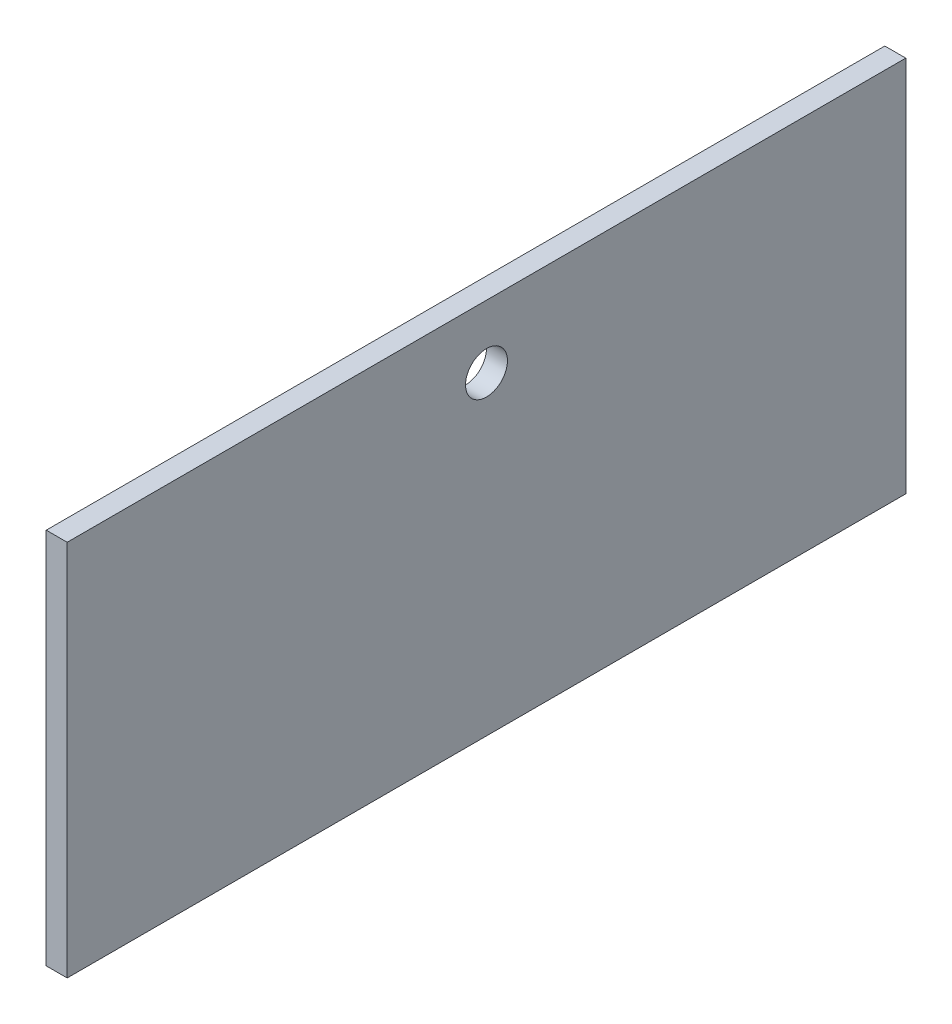
from build123d import *

# Parameters (mm, degrees)
SKETCH1_W           = 150
SKETCH1_H           = 200
BOSS_EXTRUDE1_DEPTH = 100
SHELL2_T            = -5
SKETCH5_R           = 1.9
CUT_EXTRUDE2_DEPTH  = 10
BOSS_EXTRUDE4_DEPTH = 200
SKETCH9_W           = 101.133931545
SKETCH9_H           = 31.996148617
CUT_EXTRUDE4_DEPTH  = 236.849528301
SKETCH10_R          = 4
CUT_EXTRUDE5_DEPTH  = 10
CUT_EXTRUDE7_REACH  = 162.078
SKETCH11_W          = 140
SKETCH11_H          = 5
SKETCH15_R          = 1.2
CUT_EXTRUDE11_DEPTH = 10
SKETCH36_W          = 60
SKETCH36_H          = 5
BOSS_EXTRUDE7_DEPTH = 10
SKETCH37_R          = 3.5
CUT_EXTRUDE15_DEPTH = 60
SKETCH38_R          = 5
CUT_EXTRUDE16_DEPTH = 70
SKETCH41_W          = 161.400055229
SKETCH41_H          = 90
CUT_EXTRUDE19_DEPTH = 236.849528301


with BuildPart() as part:
    # Sketch1 → Boss-Extrude1 (new body)
    with BuildSketch(Plane(origin=(0, 0, 0), x_dir=(1, 0, 0), z_dir=(0, 1, 0))):
        Rectangle(SKETCH1_W, SKETCH1_H)
    extrude(amount=BOSS_EXTRUDE1_DEPTH)

    # Shell2
    shell2_openings = [part.faces().sort_by_distance(p)[0] for p in [
        (0, 50, -100),
        (0, 50, 100),
    ]]
    offset(amount=SHELL2_T, openings=shell2_openings, kind=Kind.INTERSECTION)

    # Sketch5 → Cut-Extrude2 (cut)
    with BuildSketch(Plane.XZ):
        with Locations(Location((-65, 91, 0), (0, 0, 270))):
            Circle(SKETCH5_R)
        with Locations(Location((-35, 91, 0), (0, 0, 270))):
            Circle(SKETCH5_R)
        with Locations(Location((-65, 67, 0), (0, 0, 270))):
            Circle(SKETCH5_R)
        with Locations(Location((-35, 67, 0), (0, 0, 270))):
            Circle(SKETCH5_R)
    cut_extrude2 = extrude(amount=-CUT_EXTRUDE2_DEPTH, mode=Mode.SUBTRACT)

    # Mirror2: Cut-Extrude2 across plane
    add(cut_extrude2.mirror(Plane.XY), mode=Mode.SUBTRACT)

    # Sketch8 → Boss-Extrude4 (add, through all)
    with BuildSketch(Plane.XY.offset(100)):
        Polygon((-15, 17), (75, 17), (75, 22), (-20, 22), (-20, 0), (-15, 0), align=None)
    extrude(amount=-BOSS_EXTRUDE4_DEPTH)

    # Sketch9 → Cut-Extrude4 (cut, through all)
    with BuildSketch(Plane.XY.offset(100)):
        with Locations((35.566965773, 1.001925691)):
            Rectangle(SKETCH9_W, SKETCH9_H)
    extrude(amount=-CUT_EXTRUDE4_DEPTH, mode=Mode.SUBTRACT)

    # Sketch10 → Cut-Extrude5 (cut)
    with BuildSketch(Plane.XZ.offset(-17)):
        with Locations((60, 0)):
            Circle(SKETCH10_R)
    extrude(amount=-CUT_EXTRUDE5_DEPTH, mode=Mode.SUBTRACT)

    # Cut-Extrude7: up to this face of the body (flat: up to its plane)
    cut_extrude7_end = Plane(part.part.faces().sort_by_distance((-44.954220044, 5, 0))[0])
    # Sketch11 → Cut-Extrude7 (cut, up to the picked face)
    with BuildSketch(Plane(origin=(0, 100, 0), x_dir=(1, 0, 0), z_dir=(0, 1, 0)), mode=Mode.PRIVATE) as cut_extrude7_sk1:
        with Locations((0, -92.5)):
            Rectangle(SKETCH11_W, SKETCH11_H)
    cut_extrude7_tool1 = split(extrude(cut_extrude7_sk1.sketch, amount=-CUT_EXTRUDE7_REACH, mode=Mode.PRIVATE), bisect_by=cut_extrude7_end, keep=Keep.BOTH, mode=Mode.PRIVATE)
    cut_extrude7 = cut_extrude7_tool1.solids().sort_by(Axis((0, 100, 92.5), (0, -1, 0)))[0]
    add(cut_extrude7, mode=Mode.SUBTRACT)

    # Mirror3: Cut-Extrude7 across plane
    add(cut_extrude7.mirror(Plane.XY), mode=Mode.SUBTRACT)

    # Sketch15 → Cut-Extrude11 (cut)
    with BuildSketch(Plane(origin=(0, 100, 0), x_dir=(1, 0, 0), z_dir=(0, 1, 0))):
        with Locations(Location((50, 28, 0), (0, 0, 270))):
            Circle(SKETCH15_R)
        with Locations(Location((50, -28, 0), (0, 0, 270))):
            Circle(SKETCH15_R)
        with Locations(Location((-20, 20, 0), (0, 0, 270))):
            Circle(SKETCH15_R)
        with Locations(Location((-20, -20, 0), (0, 0, 270))):
            Circle(SKETCH15_R)
    extrude(amount=-CUT_EXTRUDE11_DEPTH, mode=Mode.SUBTRACT)

    # Sketch36 → Boss-Extrude7 (add)
    with BuildSketch(Plane.ZY.offset(-70)):
        with Locations((-13.202053215, 62.5)):
            Rectangle(SKETCH36_W, SKETCH36_H)
    boss_extrude7 = extrude(amount=BOSS_EXTRUDE7_DEPTH)

    # Mirror5: Boss-Extrude7 across plane
    add(boss_extrude7.mirror(Plane(origin=(0, 0, 0), x_dir=(0, 0, 1), z_dir=(1, 0, 0))))

    # Sketch37 → Cut-Extrude15 (cut)
    with BuildSketch(Plane(origin=(75, 0, 0), x_dir=(0, 0, -1), z_dir=(1, 0, 0))):
        with Locations((0, 75)):
            Circle(SKETCH37_R)
    extrude(amount=-CUT_EXTRUDE15_DEPTH, mode=Mode.SUBTRACT)

    # Sketch38 → Cut-Extrude16 (cut)
    with BuildSketch(Plane.ZY.offset(75)):
        with Locations((0, 80)):
            Circle(SKETCH38_R)
    extrude(amount=-CUT_EXTRUDE16_DEPTH, mode=Mode.SUBTRACT)

    # Sketch41 → Cut-Extrude19 (cut, through all)
    with BuildSketch(Plane.XY.offset(100)):
        Polygon((-133.177931689, 95), (-70, 95), (91.400055229, 95), (91.400055229, 145.714177441), (-133.177931689, 145.714177441), align=None)
        with Locations((10.700027615, 50)):
            Rectangle(SKETCH41_W, SKETCH41_H)
        Polygon((91.400055229, 5), (-70, 5), (-160.904455041, 5), (-160.904455041, -24.977011319), (91.400055229, -24.977011319), align=None)
    extrude(amount=-CUT_EXTRUDE19_DEPTH, mode=Mode.SUBTRACT)


solid = part.part
